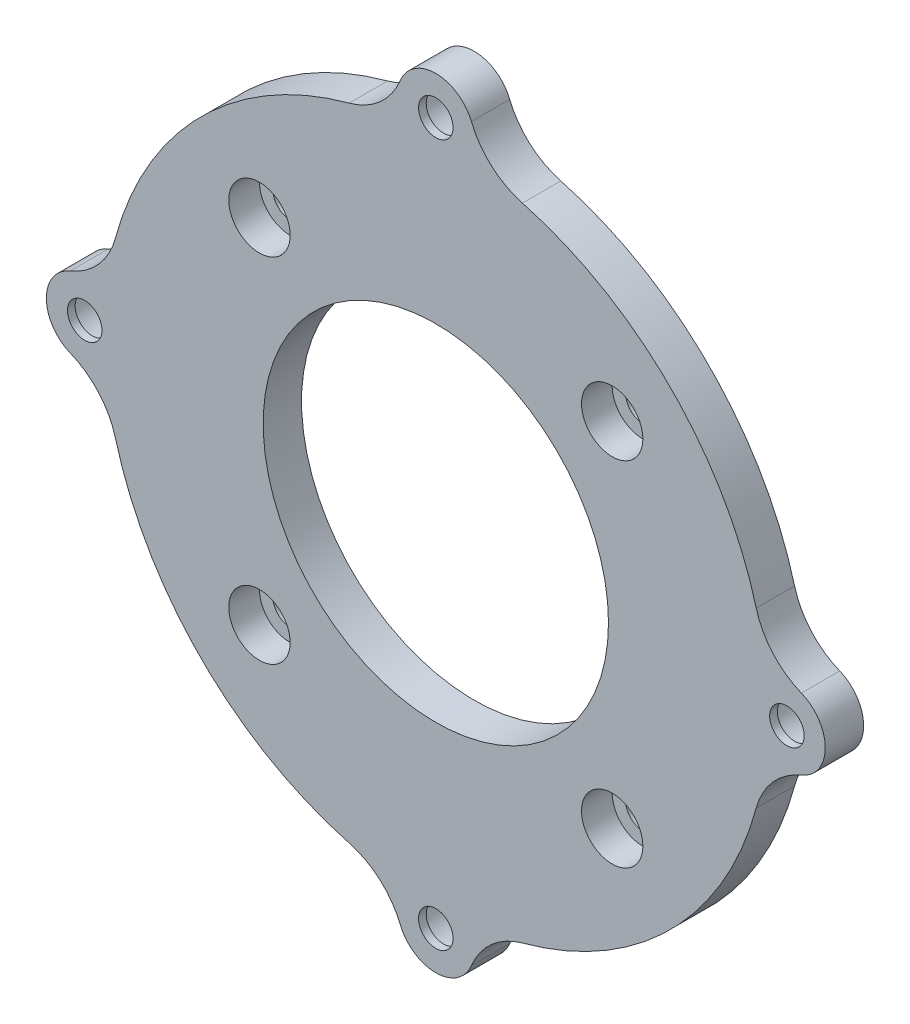
from build123d import *

# Parameters (mm, degrees)
SKETCH1_R           = 2.25
SKETCH1_R_2         = 22.5
BOSS_EXTRUDE1_DEPTH = 2.5
SKETCH3_R           = 4
CUT_EXTRUDE2_DEPTH  = 4
SKETCH4_R           = 4
CUT_EXTRUDE3_DEPTH  = 4


with BuildPart() as part:
    # Sketch1 → Boss-Extrude1 (new, symmetric)
    with BuildSketch(Plane.XY):
        with BuildLine():
            ThreePointArc((4.630966194, 47.635245902), (0, 50.75), (-4.630966194, 47.635245902))
            ThreePointArc((-4.630966194, 47.635245902), (-7.268500835, 43.914585958), (-11.283903543, 41.752078042))
            ThreePointArc((-11.283903543, 41.752078042), (-30.582368286, 30.582368286), (-41.752078042, 11.283903543))
            ThreePointArc((-41.752078042, 11.283903543), (-43.914585958, 7.268500835), (-47.635245902, 4.630966194))
            ThreePointArc((-47.635245902, 4.630966194), (-50.75, 0), (-47.635245902, -4.630966194))
            ThreePointArc((-47.635245902, -4.630966194), (-43.914585958, -7.268500835), (-41.752078042, -11.283903543))
            ThreePointArc((-41.752078042, -11.283903543), (-30.582368286, -30.582368286), (-11.283903543, -41.752078042))
            ThreePointArc((-11.283903543, -41.752078042), (-7.268500835, -43.914585958), (-4.630966194, -47.635245902))
            ThreePointArc((-4.630966194, -47.635245902), (0, -50.75), (4.630966194, -47.635245902))
            ThreePointArc((4.630966194, -47.635245902), (7.268500835, -43.914585958), (11.283903543, -41.752078042))
            ThreePointArc((11.283903543, -41.752078042), (30.582368286, -30.582368286), (41.752078042, -11.283903543))
            ThreePointArc((41.752078042, -11.283903543), (43.914585958, -7.268500835), (47.635245902, -4.630966194))
            ThreePointArc((47.635245902, -4.630966194), (50.75, 0), (47.635245902, 4.630966194))
            ThreePointArc((47.635245902, 4.630966194), (43.914585958, 7.268500835), (41.752078042, 11.283903543))
            ThreePointArc((41.752078042, 11.283903543), (30.582368286, 30.582368286), (11.283903543, 41.752078042))
            ThreePointArc((11.283903543, 41.752078042), (7.268500835, 43.914585958), (4.630966194, 47.635245902))
        make_face()
        with Locations((-45.75, 0)):
            Circle(SKETCH1_R, mode=Mode.SUBTRACT)
        with Locations((0, 45.75)):
            Circle(SKETCH1_R, mode=Mode.SUBTRACT)
        with Locations((45.75, 0)):
            Circle(SKETCH1_R, mode=Mode.SUBTRACT)
        with Locations((0, -45.75)):
            Circle(SKETCH1_R, mode=Mode.SUBTRACT)
        with Locations((-22.980970389, 22.980970389)):
            Circle(SKETCH1_R, mode=Mode.SUBTRACT)
        with Locations((22.980970389, 22.980970389)):
            Circle(SKETCH1_R, mode=Mode.SUBTRACT)
        with Locations((22.980970389, -22.980970389)):
            Circle(SKETCH1_R, mode=Mode.SUBTRACT)
        with Locations((-22.980970389, -22.980970389)):
            Circle(SKETCH1_R, mode=Mode.SUBTRACT)
        Circle(SKETCH1_R_2, mode=Mode.SUBTRACT)
    extrude(amount=BOSS_EXTRUDE1_DEPTH, both=True)

    # Sketch3 → Cut-Extrude2 (cut)
    with BuildSketch(Plane.XY.offset(2.5)):
        with Locations((-22.980970389, -22.980970389)):
            Circle(SKETCH3_R)
        with Locations((-22.980970389, 22.980970389)):
            Circle(SKETCH3_R)
        with Locations((22.980970389, 22.980970389)):
            Circle(SKETCH3_R)
        with Locations((22.980970389, -22.980970389)):
            Circle(SKETCH3_R)
    extrude(amount=-CUT_EXTRUDE2_DEPTH, mode=Mode.SUBTRACT)

    # Sketch4 → Cut-Extrude3 (cut)
    with BuildSketch(Plane(origin=(0, 0, -2.5), x_dir=(-1, 0, 0), z_dir=(0, 0, -1))):
        with Locations((0, 45.75)):
            Circle(SKETCH4_R)
        with Locations((45.75, 0)):
            Circle(SKETCH4_R)
        with Locations((0, -45.75)):
            Circle(SKETCH4_R)
        with Locations((-45.75, 0)):
            Circle(SKETCH4_R)
    extrude(amount=-CUT_EXTRUDE3_DEPTH, mode=Mode.SUBTRACT)


solid = part.part
